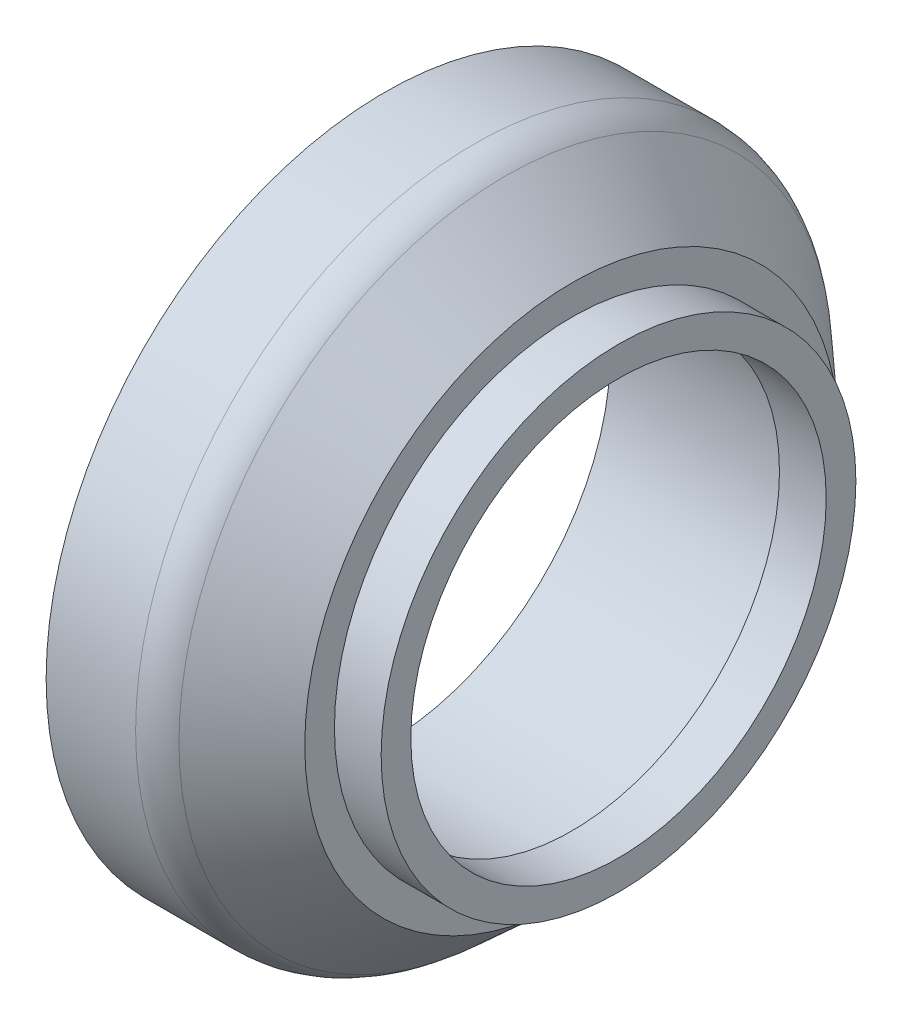
from build123d import *

# Parameters (mm, degrees)
ZAOKR_GLENIE1_R                  = 10
SZKIC2_R                         = 50.8
SZKIC2_R_2                       = 44.45
DODANIE_WYCI_GNI_CIE1_DEPTH      = 10
SZKIC3_R                         = 5.35
WYTNIJ_WYCI_GNI_CIE1_DEPTH       = 19.4
SFAZOWANIE1_SIZE                 = 1
SZYK_KO_OWY1_COUNT               = 12
SFAZOWANIE1_OF_SZYK_KO_OWY1_SIZE = 1


with BuildPart() as part:
    # Szkic1 → Obrót1 (revolve)
    with BuildSketch(Plane.XY, mode=Mode.PRIVATE) as obr_t1_sk:
        Polygon((0, 48.25), (40, 48.25), (40, 57.15), (23, 72.5), (0, 72.5), align=None)
    revolve(obr_t1_sk.sketch.rotate(Axis((0, 0, 0), (1, 0, 0)), 90), axis=Axis((0, 0, 0), (1, 0, 0)))

    # Zaokrąglenie1
    zaokr_glenie1_edges = [part.edges().sort_by_distance(p)[0] for p in [
        (23, 0, -72.5),
    ]]
    fillet(zaokr_glenie1_edges, radius=ZAOKR_GLENIE1_R)

    # Szkic2 → Dodanie-wyciągnięcie1 (add)
    with BuildSketch(Plane(origin=(40, 0, 0), x_dir=(0, 0, -1), z_dir=(1, 0, 0))):
        with Locations(Location((0, 0, 0), (0, 0, 180))):
            Circle(SZKIC2_R)
        Circle(SZKIC2_R_2, mode=Mode.SUBTRACT)
    extrude(amount=DODANIE_WYCI_GNI_CIE1_DEPTH)

    # Szkic3 → Wytnij-wyciągnięcie1 (cut)
    with BuildSketch(Plane.ZY):
        with Locations((0, 62.5)):
            Circle(SZKIC3_R)
    wytnij_wyci_gni_cie1 = extrude(amount=-WYTNIJ_WYCI_GNI_CIE1_DEPTH, mode=Mode.SUBTRACT)

    # Sfazowanie1
    sfazowanie1_edges = [part.edges().sort_by_distance(p)[0] for p in [
        (0, 62.5, -5.35),
    ]]
    chamfer(sfazowanie1_edges, length=SFAZOWANIE1_SIZE)

    # Szyk kołowy1: Wytnij-wyciągnięcie1 ×12 about axis
    szyk_ko_owy1_axis = Axis((0, 0, 0), (1, 0, 0))
    for i in range(1, SZYK_KO_OWY1_COUNT):
        add(wytnij_wyci_gni_cie1.rotate(szyk_ko_owy1_axis, i * 360 / SZYK_KO_OWY1_COUNT), mode=Mode.SUBTRACT)

    # Sfazowanie1 of Szyk kołowy1
    sfazowanie1_of_szyk_ko_owy1_edges = [part.edges().sort_by_distance(p)[0] for p in [
        (0, 56.801587737, 26.61676409),
        (0, 35.88323591, 51.451587737),
        (0, 5.35, 62.5),
        (0, -26.61676409, 56.801587737),
        (0, -51.451587737, 35.88323591),
        (0, -62.5, 5.35),
        (0, -56.801587737, -26.61676409),
        (0, -35.88323591, -51.451587737),
        (0, -5.35, -62.5),
        (0, 26.61676409, -56.801587737),
        (0, 51.451587737, -35.88323591),
    ]]
    chamfer(sfazowanie1_of_szyk_ko_owy1_edges, length=SFAZOWANIE1_OF_SZYK_KO_OWY1_SIZE)


solid = part.part
